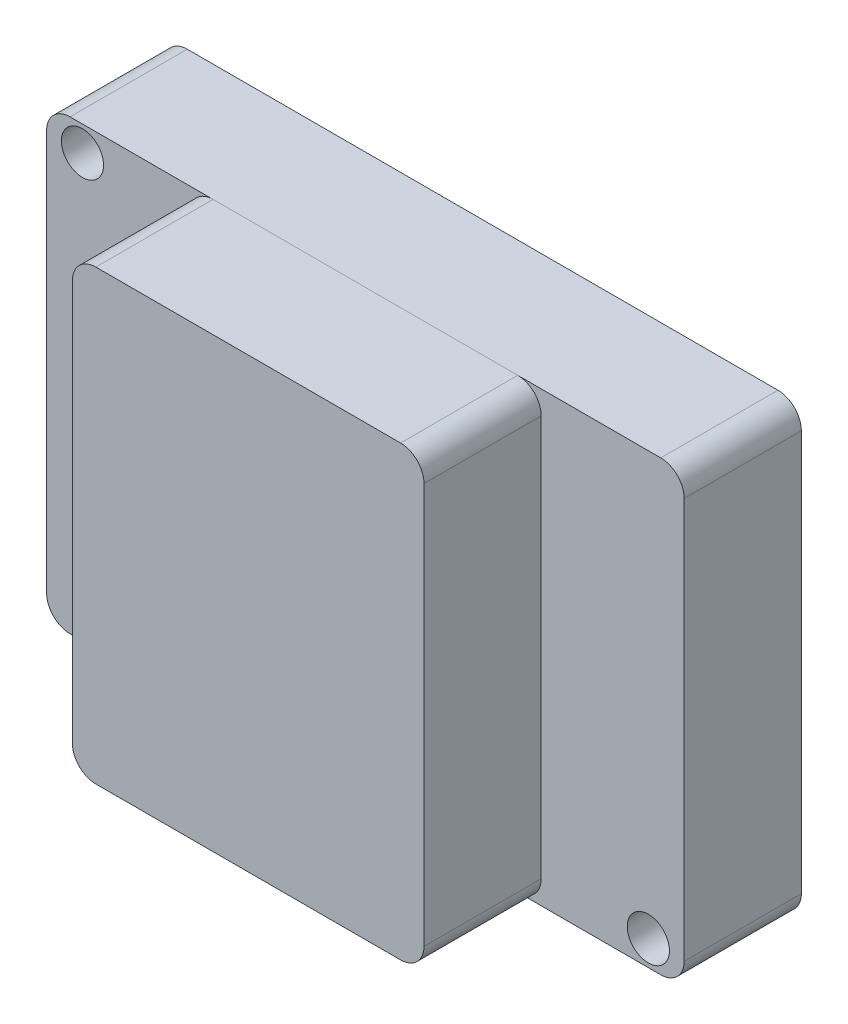
from build123d import *

# Parameters (mm, degrees)
SKETCH1_W           = 69.088
SKETCH1_H           = 48.514
SKETCH1_R           = 2.286
BOSS_EXTRUDE1_DEPTH = 12.7
SKETCH2_W           = 38.1
SKETCH2_H           = 48.514
BOSS_EXTRUDE2_DEPTH = 12.7
FILLET1_R           = 2.54
FILLET2_R           = 2.54


with BuildPart() as part:
    # Sketch1 → Boss-Extrude1 (new body)
    with BuildSketch(Plane.XY):
        Rectangle(SKETCH1_W, SKETCH1_H)
        with Locations((-30.660716006, 21.530135137)):
            Circle(SKETCH1_R, mode=Mode.SUBTRACT)
        with Locations((30.660716006, -21.530135137)):
            Circle(SKETCH1_R, mode=Mode.SUBTRACT)
    extrude(amount=BOSS_EXTRUDE1_DEPTH)

    # Fillet1
    fillet1_edges = [part.edges().sort_by_distance(p)[0] for p in [
        (34.544, -24.257, 6.35),
        (-34.544, -24.257, 6.35),
        (-34.544, 24.257, 6.35),
        (34.544, 24.257, 6.35),
    ]]
    fillet(fillet1_edges, radius=FILLET1_R)


with BuildPart() as body_2:
    # Sketch2 → Boss-Extrude2 (new body)
    with BuildSketch(Plane.XY.offset(12.7)):
        Rectangle(SKETCH2_W, SKETCH2_H)
    extrude(amount=BOSS_EXTRUDE2_DEPTH)

    # Fillet2
    fillet2_edges = [body_2.edges().sort_by_distance(p)[0] for p in [
        (19.05, -24.257, 19.05),
        (-19.05, -24.257, 19.05),
        (-19.05, 24.257, 19.05),
        (19.05, 24.257, 19.05),
    ]]
    fillet(fillet2_edges, radius=FILLET2_R)


solid = Compound([part.part, body_2.part])
